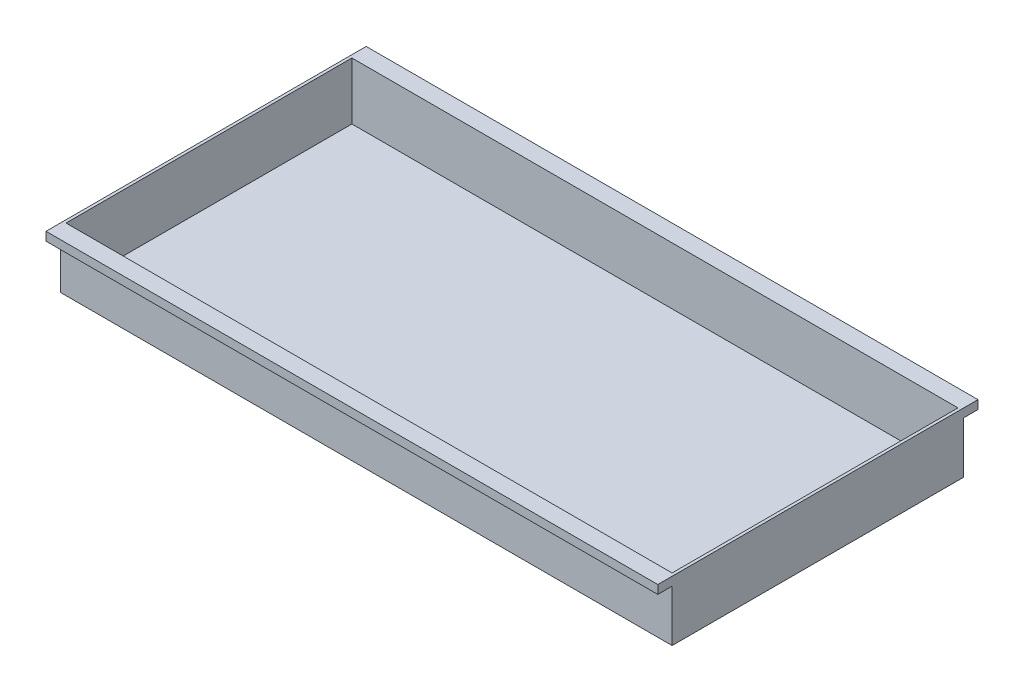
from build123d import *

# Parameters (mm, degrees)
CROQUIS1_W            = 1070
CROQUIS1_H            = 510
CROQUIS1_W_2          = 1060
CROQUIS1_H_2          = 500
EXTRUIR_L_MINA1_DEPTH = 100
CROQUIS2_W            = 1070
CROQUIS2_H            = 510
EXTRUIR1_DEPTH        = 5
CROQUIS3_W            = 1070
CROQUIS3_H            = 25
EXTRUIR2_DEPTH        = 15


with BuildPart() as part:
    # Croquis1 → Extruir-Lámina1 (new body)
    with BuildSketch(Plane(origin=(0, 0, 0), x_dir=(1, 0, 0), z_dir=(0, 1, 0))):
        Rectangle(CROQUIS1_W, CROQUIS1_H)
        Rectangle(CROQUIS1_W_2, CROQUIS1_H_2, mode=Mode.SUBTRACT)
    extrude(amount=-EXTRUIR_L_MINA1_DEPTH)

    # Croquis2 → Extruir1 (add)
    with BuildSketch(Plane.XZ.offset(100)):
        Rectangle(CROQUIS2_W, CROQUIS2_H)
    extrude(amount=EXTRUIR1_DEPTH)

    # Croquis3 → Extruir2 (add)
    with BuildSketch(Plane(origin=(0, 0, 0), x_dir=(1, 0, 0), z_dir=(0, 1, 0))):
        with Locations((0, 267.5)):
            Rectangle(CROQUIS3_W, CROQUIS3_H)
        with Locations((0, -267.5)):
            Rectangle(CROQUIS3_W, CROQUIS3_H)
    extrude(amount=-EXTRUIR2_DEPTH)


solid = part.part
